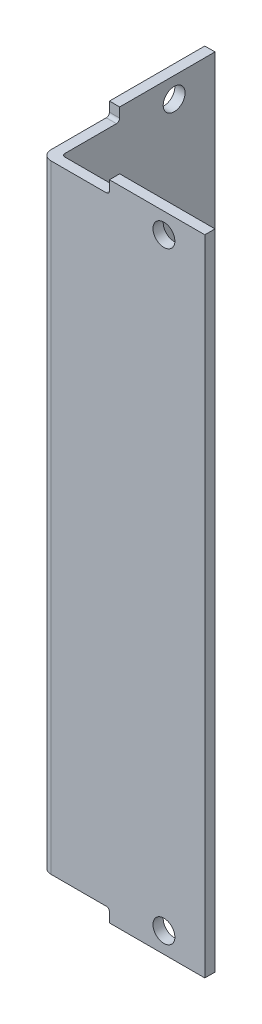
from build123d import *

# Parameters (mm, degrees)
SKETCH1_W            = 25.4
SKETCH1_H            = 25.4
BOSS_EXTRUDE1_DEPTH  = 56.75
SKETCH2_W            = 23.8125
SKETCH2_H            = 23.8125
CUT_EXTRUDE1_DEPTH   = 115.912270885
FILLET1_R            = 0.508
M3_CLEARANCE_HOLE1_D = 3.4
M3_CLEARANCE_HOLE2_D = 3.4
M3_CLEARANCE_HOLE3_D = 3.4
M3_CLEARANCE_HOLE4_D = 3.4
FILLET2_R            = 1.5
CUT_EXTRUDE2_REACH   = 65.459
SKETCH11_W           = 16.9
SKETCH11_H           = 6.499999954
SKETCH11_H_2         = 7
CUT_EXTRUDE3_REACH   = 65.459
SKETCH12_W           = 16.9
SKETCH12_H           = 6.5
SKETCH12_H_2         = 7
FILLET3_R            = 3.81
CUT_EXTRUDE4_REACH   = 65.459
SKETCH13_W           = 15.4
SKETCH13_H           = 87.3
CUT_EXTRUDE5_REACH   = 65.459
SKETCH14_W           = 15.4
SKETCH14_H           = 87.3
CHAMFER2_SIZE        = 6.35
FILLET5_R            = 3.81
SKETCH15_W           = 12.31
SKETCH15_H           = 12.31
CUT_EXTRUDE6_DEPTH   = 6.5
SKETCH17_W           = 12.31
SKETCH17_H           = 12.31
CUT_EXTRUDE8_DEPTH   = 7
BOSS_EXTRUDE2_START  = -1.5875
BOSS_EXTRUDE2_DEPTH  = 1.5875
BOSS_EXTRUDE3_START  = -1.5875
BOSS_EXTRUDE3_DEPTH  = 1.5875
SKETCH22_W           = 10.5875
SKETCH22_H           = 10.5875
CUT_EXTRUDE9_DEPTH   = 2
FILLET6_R            = 0.5
FILLET6_OF_MIRROR1_R = 0.5


with BuildPart() as part:
    # Sketch1 → Boss-Extrude1 (new, symmetric)
    with BuildSketch(Plane(origin=(0, 0, 0), x_dir=(1, 0, 0), z_dir=(0, 1, 0))):
        Rectangle(SKETCH1_W, SKETCH1_H)
    extrude(amount=BOSS_EXTRUDE1_DEPTH, both=True)

    # Sketch2 → Cut-Extrude1 (cut, through all)
    with BuildSketch(Plane(origin=(0, 56.75, 0), x_dir=(1, 0, 0), z_dir=(0, 1, 0))):
        with Locations((0.79375, 0.79375)):
            Rectangle(SKETCH2_W, SKETCH2_H)
    extrude(amount=-CUT_EXTRUDE1_DEPTH, mode=Mode.SUBTRACT)

    # Fillet1
    fillet1_edges = [part.edges().sort_by_distance(p)[0] for p in [
        (-11.1125, 0, 11.1125),
    ]]
    fillet(fillet1_edges, radius=FILLET1_R)

    # M3 Clearance Hole1 (through all)
    with Locations(Plane.XY.offset(12.7)):
        with Locations((6.35, 47.075)):
            Hole(M3_CLEARANCE_HOLE1_D / 2)

    # M3 Clearance Hole2 (through all)
    with Locations(Plane.ZY.offset(12.7)):
        with Locations((-6.35, 47.075)):
            Hole(M3_CLEARANCE_HOLE2_D / 2)

    # M3 Clearance Hole3 (through all)
    with Locations(Plane.XY.offset(12.7)):
        with Locations((6.35, -46.575)):
            Hole(M3_CLEARANCE_HOLE3_D / 2)

    # M3 Clearance Hole4 (through all)
    with Locations(Plane.ZY.offset(12.7)):
        with Locations((-6.35, -46.575)):
            Hole(M3_CLEARANCE_HOLE4_D / 2)

    # Fillet2
    fillet2_edges = [part.edges().sort_by_distance(p)[0] for p in [
        (-12.7, 0, 12.7),
    ]]
    fillet(fillet2_edges, radius=FILLET2_R)

    # Sketch11 → Cut-Extrude2 (cut, up to next)
    with BuildSketch(Plane.ZY.offset(12.7), mode=Mode.PRIVATE) as cut_extrude2_sk1:
        with Locations((-4.25, 53.500000023)):
            Rectangle(SKETCH11_W, SKETCH11_H)
    cut_extrude2_tool1 = extrude(cut_extrude2_sk1.sketch, amount=-CUT_EXTRUDE2_REACH, mode=Mode.PRIVATE) & part.part
    # Sketch11 → Cut-Extrude2 (cut, up to next)
    with BuildSketch(Plane.ZY.offset(12.7), mode=Mode.PRIVATE) as cut_extrude2_sk2:
        with Locations((-4.25, -53.25)):
            Rectangle(SKETCH11_W, SKETCH11_H_2)
    cut_extrude2_tool2 = extrude(cut_extrude2_sk2.sketch, amount=-CUT_EXTRUDE2_REACH, mode=Mode.PRIVATE) & part.part
    add(cut_extrude2_tool1.solids().sort_by_distance((-12.7, 53.5, -4.25))[0], mode=Mode.SUBTRACT)
    add(cut_extrude2_tool2.solids().sort_by_distance((-12.7, -53.25, -4.25))[0], mode=Mode.SUBTRACT)

    # Sketch12 → Cut-Extrude3 (cut, up to next)
    with BuildSketch(Plane.XY.offset(12.7), mode=Mode.PRIVATE) as cut_extrude3_sk1:
        with Locations((4.25, 53.5)):
            Rectangle(SKETCH12_W, SKETCH12_H)
    cut_extrude3_tool1 = extrude(cut_extrude3_sk1.sketch, amount=-CUT_EXTRUDE3_REACH, mode=Mode.PRIVATE) & part.part
    # Sketch12 → Cut-Extrude3 (cut, up to next)
    with BuildSketch(Plane.XY.offset(12.7), mode=Mode.PRIVATE) as cut_extrude3_sk2:
        with Locations((4.25, -53.25)):
            Rectangle(SKETCH12_W, SKETCH12_H_2)
    cut_extrude3_tool2 = extrude(cut_extrude3_sk2.sketch, amount=-CUT_EXTRUDE3_REACH, mode=Mode.PRIVATE) & part.part
    add(cut_extrude3_tool1.solids().sort_by_distance((4.25, 53.5, 12.7))[0], mode=Mode.SUBTRACT)
    add(cut_extrude3_tool2.solids().sort_by_distance((4.25, -53.25, 12.7))[0], mode=Mode.SUBTRACT)

    # Fillet3
    fillet3_edges = [part.edges().sort_by_distance(p)[0] for p in [
        (-4.2, 50.25, 11.90625),
        (-4.2, -49.75, 11.90625),
        (-11.90625, 50.250000046, 4.2),
        (-11.90625, -49.75, 4.2),
    ]]
    fillet(fillet3_edges, radius=FILLET3_R)

    # Sketch13 → Cut-Extrude4 (cut, up to next)
    with BuildSketch(Plane.ZY.offset(12.7), mode=Mode.PRIVATE) as cut_extrude4_sk1:
        with Locations((-5, 0.25)):
            Rectangle(SKETCH13_W, SKETCH13_H)
    cut_extrude4_tool1 = extrude(cut_extrude4_sk1.sketch, amount=-CUT_EXTRUDE4_REACH, mode=Mode.PRIVATE) & part.part
    add(cut_extrude4_tool1.solids().sort_by_distance((-12.7, 0.25, -5))[0], mode=Mode.SUBTRACT)

    # Sketch14 → Cut-Extrude5 (cut, up to next)
    with BuildSketch(Plane.XY.offset(12.7), mode=Mode.PRIVATE) as cut_extrude5_sk1:
        with Locations((5, 0.25)):
            Rectangle(SKETCH14_W, SKETCH14_H)
    cut_extrude5_tool1 = extrude(cut_extrude5_sk1.sketch, amount=-CUT_EXTRUDE5_REACH, mode=Mode.PRIVATE) & part.part
    add(cut_extrude5_tool1.solids().sort_by_distance((5, 0.25, 12.7))[0], mode=Mode.SUBTRACT)

    # Chamfer2
    chamfer2_edges = [part.edges().sort_by_distance(p)[0] for p in [
        (-11.90625, 43.9, 2.7),
        (-11.90625, -43.4, 2.7),
        (-2.7, -43.4, 11.90625),
        (-2.7, 43.9, 11.90625),
    ]]
    chamfer(chamfer2_edges, length=CHAMFER2_SIZE)

    # Fillet5
    fillet5_edges = [part.edges().sort_by_distance(p)[0] for p in [
        (-11.90625, 43.9, -3.65),
        (-11.90625, -37.05, 2.7),
        (-11.90625, 37.55, 2.7),
        (-2.7, -37.05, 11.90625),
        (-2.7, 37.55, 11.90625),
        (3.65, 43.9, 11.90625),
        (3.65, -43.4, 11.90625),
        (-11.90625, -43.4, -3.65),
    ]]
    fillet(fillet5_edges, radius=FILLET5_R)

    # Sketch15 → Cut-Extrude6 (cut)
    with BuildSketch(Plane(origin=(0, 56.75, 0), x_dir=(1, 0, 0), z_dir=(0, 1, 0))):
        with Locations((-6.545, -6.545)):
            Rectangle(SKETCH15_W, SKETCH15_H)
    extrude(amount=-CUT_EXTRUDE6_DEPTH, mode=Mode.SUBTRACT)

    # Sketch17 → Cut-Extrude8 (cut)
    with BuildSketch(Plane.XZ.offset(56.75)):
        with Locations((-6.545, 6.545)):
            Rectangle(SKETCH17_W, SKETCH17_H)
    extrude(amount=-CUT_EXTRUDE8_DEPTH, mode=Mode.SUBTRACT)

    # Sketch20 → Boss-Extrude2 (add)
    with BuildSketch(Plane.ZY.offset(12.7).offset(BOSS_EXTRUDE2_START)):
        with BuildLine():
            Line((-12.7, 43.9), (-12.7, -43.4))
            Line((-12.7, -43.4), (-5.228153673, -43.4))
            ThreePointArc((-5.228153673, -43.4), (-3.770129795, -43.109981019), (-2.534076836, -42.284076836))
            Line((-2.534076836, -42.284076836), (1.584076836, -38.165923164))
            ThreePointArc((1.584076836, -38.165923164), (2.409981019, -36.929870205), (2.7, -35.471846327))
            Line((2.7, -35.471846327), (2.7, 35.971846327))
            ThreePointArc((2.7, 35.971846327), (2.409981019, 37.429870205), (1.584076836, 38.665923164))
            Line((1.584076836, 38.665923164), (-2.534076836, 42.784076836))
            ThreePointArc((-2.534076836, 42.784076836), (-3.770129795, 43.609981019), (-5.228153673, 43.9))
            Line((-5.228153673, 43.9), (-12.7, 43.9))
        make_face()
    extrude(amount=BOSS_EXTRUDE2_DEPTH)

    # Sketch21 → Boss-Extrude3 (add)
    with BuildSketch(Plane.XY.offset(12.7).offset(BOSS_EXTRUDE3_START)):
        with BuildLine():
            Line((12.7, 43.9), (12.7, -43.4))
            Line((12.7, -43.4), (5.228153673, -43.4))
            ThreePointArc((5.228153673, -43.4), (3.770129795, -43.109981019), (2.534076836, -42.284076836))
            Line((2.534076836, -42.284076836), (-1.584076836, -38.165923164))
            ThreePointArc((-1.584076836, -38.165923164), (-2.409981019, -36.929870205), (-2.7, -35.471846327))
            Line((-2.7, -35.471846327), (-2.7, 35.971846327))
            ThreePointArc((-2.7, 35.971846327), (-2.409981019, 37.429870205), (-1.584076836, 38.665923164))
            Line((-1.584076836, 38.665923164), (2.534076836, 42.784076836))
            ThreePointArc((2.534076836, 42.784076836), (3.770129795, 43.609981019), (5.228153673, 43.9))
            Line((5.228153673, 43.9), (12.7, 43.9))
        make_face()
    extrude(amount=BOSS_EXTRUDE3_DEPTH)

    # Sketch22 → Cut-Extrude9 (cut)
    with BuildSketch(Plane(origin=(0, 50.250000046, 0), x_dir=(1, 0, 0), z_dir=(0, 1, 0))):
        with Locations((-7.40625, -7.40625)):
            Rectangle(SKETCH22_W, SKETCH22_H)
    cut_extrude9 = extrude(amount=-CUT_EXTRUDE9_DEPTH, mode=Mode.SUBTRACT)

    # Fillet6
    fillet6_edges = [part.edges().sort_by_distance(p)[0] for p in [
        (-11.90625, 48.250000046, 2.1125),
        (-2.1125, 48.250000046, 11.90625),
    ]]
    fillet(fillet6_edges, radius=FILLET6_R)

    # Mirror1: Cut-Extrude9 across plane
    add(cut_extrude9.mirror(Plane.ZX.offset(0.250000023)), mode=Mode.SUBTRACT)

    # Fillet6 of Mirror1
    fillet6_of_mirror1_edges = [part.edges().sort_by_distance(p)[0] for p in [
        (-11.90625, -47.75, 2.1125),
        (-2.1125, -47.75, 11.90625),
    ]]
    fillet(fillet6_of_mirror1_edges, radius=FILLET6_OF_MIRROR1_R)


solid = part.part
